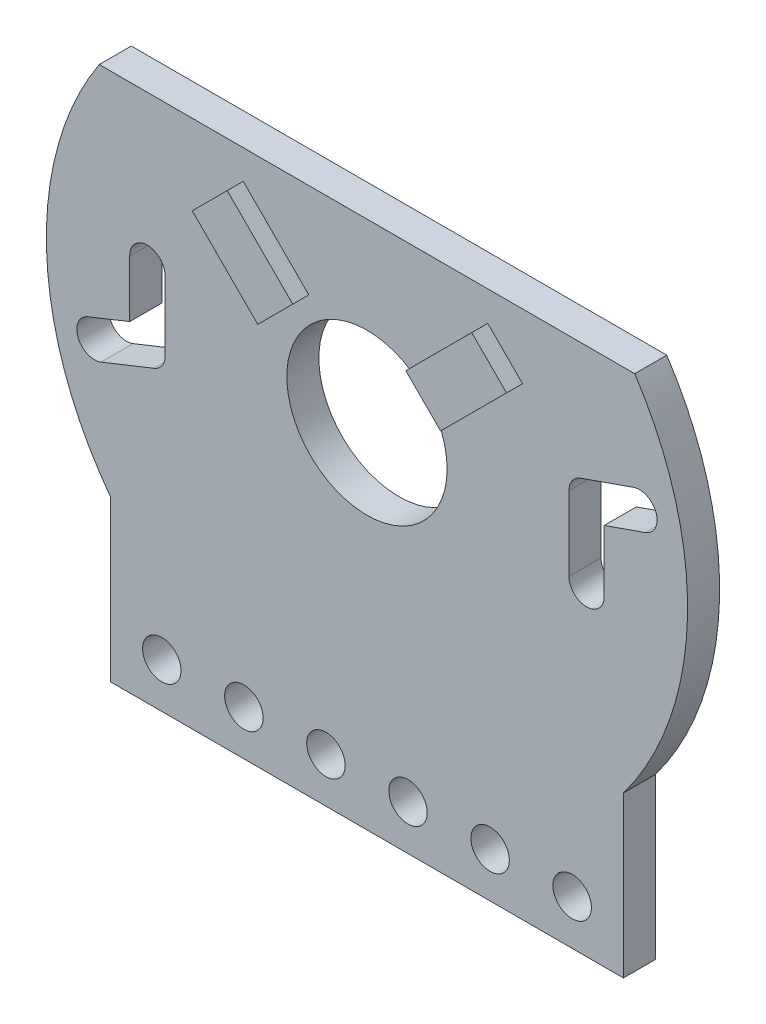
from build123d import *

# Parameters (mm, degrees)
ESQUISSE1_R             = 2.5
ESQUISSE1_R_2           = 0.6
BOSS_EXTRU_1_DEPTH      = 1
ENL_V_MAT_EXTRU_1_DEPTH = 15.899664426
BOSS_EXTRU_2_DEPTH      = 0.5
BOSS_EXTRU_3_DEPTH      = 0.5


with BuildPart() as part:
    # Esquisse1 → Boss.-Extru.1 (new body)
    with BuildSketch(Plane.XY):
        with BuildLine():
            Line((-8.351646544, 5.5), (8.351646544, 5.5))
            ThreePointArc((8.351646544, 5.5), (9.995328218, -0.30563675), (8, -6))
            Line((8, -6), (8, -11))
            Line((8, -11), (-8, -11))
            Line((-8, -11), (-8, -6))
            ThreePointArc((-8, -6), (-9.995328218, -0.30563675), (-8.351646544, 5.5))
        make_face()
        Circle(ESQUISSE1_R, mode=Mode.SUBTRACT)
        with Locations((-6.4, -9.6)):
            Circle(ESQUISSE1_R_2, mode=Mode.SUBTRACT)
        with Locations((-3.84, -9.6)):
            Circle(ESQUISSE1_R_2, mode=Mode.SUBTRACT)
        with Locations((-1.28, -9.6)):
            Circle(ESQUISSE1_R_2, mode=Mode.SUBTRACT)
        with Locations((1.28, -9.6)):
            Circle(ESQUISSE1_R_2, mode=Mode.SUBTRACT)
        with Locations((3.84, -9.6)):
            Circle(ESQUISSE1_R_2, mode=Mode.SUBTRACT)
        with Locations((6.4, -9.6)):
            Circle(ESQUISSE1_R_2, mode=Mode.SUBTRACT)
        with BuildLine():
            Line((-6.3, 0.8), (-6.3, -1.444183839))
            ThreePointArc((-6.3, -1.444183839), (-6.419746949, -1.690835185), (-6.641967863, -1.851440553))
            Line((-6.641967863, -1.851440553), (-8.292953638, -2.509553847))
            ThreePointArc((-8.292953638, -2.509553847), (-9.009553847, -2.207046362), (-8.707046362, -1.490446153))
            Line((-8.707046362, -1.490446153), (-7.4, -0.969433434))
            Line((-7.4, -0.969433434), (-7.4, 0.8))
            ThreePointArc((-7.4, 0.8), (-6.85, 1.370822155), (-6.3, 0.8))
        make_face(mode=Mode.SUBTRACT)
        with BuildLine():
            Line((7.4, 1.315402872), (7.4, -1))
            ThreePointArc((7.4, -1), (6.85, -1.55), (6.3, -1))
            Line((6.3, -1), (6.3, 1.315402872))
            ThreePointArc((6.3, 1.315402872), (6.85, 1.865402872), (7.4, 1.315402872))
        make_face(mode=Mode.SUBTRACT)
    extrude(amount=BOSS_EXTRU_1_DEPTH)

    # Esquisse2 → Enlèv. mat.-Extru.1 (cut, through all)
    with BuildSketch(Plane.XY.offset(1)):
        with BuildLine():
            Line((6.668307266, 1.834524968), (8.317330789, 2.411683201))
            ThreePointArc((8.317330789, 2.411683201), (9.018145619, 2.074253838), (8.680716257, 1.373439009))
            Line((8.680716257, 1.373439009), (7.031692734, 0.796280776))
            ThreePointArc((7.031692734, 0.796280776), (6.330877904, 1.133710138), (6.668307266, 1.834524968))
        make_face()
    extrude(amount=-ENL_V_MAT_EXTRU_1_DEPTH, mode=Mode.SUBTRACT)

    # Esquisse3 → Boss.-Extru.2 (add)
    with BuildSketch(Plane.XY.offset(1)):
        Polygon((-4.950824849, 3.498836933), (-2.906168647, 1.454180731), (-1.81491955, 2.545429827), (-3.859575753, 4.59008603), align=None)
    extrude(amount=BOSS_EXTRU_2_DEPTH)

    # Esquisse4 → Boss.-Extru.3 (add)
    with BuildSketch(Plane.XY.offset(1)):
        Polygon((1.711538057, 2.510969329), (3.767681092, 4.567112364), (4.853186772, 3.481606684), (2.797043737, 1.425463649), align=None)
    extrude(amount=BOSS_EXTRU_3_DEPTH)


solid = part.part
